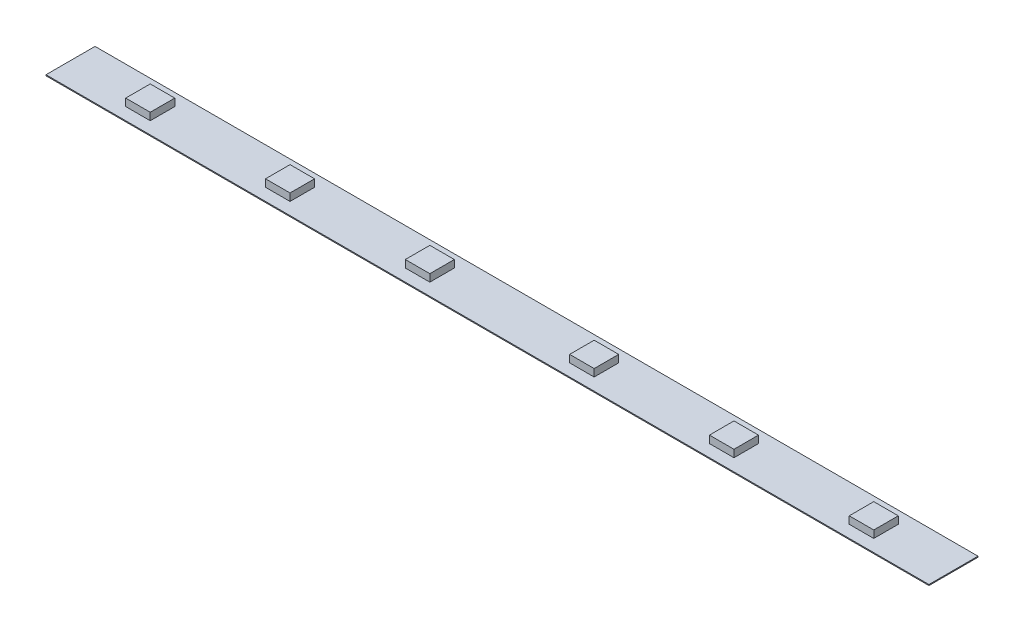
from build123d import *

# Parameters (mm, degrees)
ESQUISSE1_W        = 180
ESQUISSE1_H        = 10
BOSS_EXTRU_1_DEPTH = 0.2
ESQUISSE3_W        = 5
ESQUISSE3_H        = 5
BOSS_EXTRU_2_DEPTH = 1.5


with BuildPart() as part:
    # Esquisse1 → Boss.-Extru.1 (new body)
    with BuildSketch(Plane(origin=(0, 0, 0), x_dir=(1, 0, 0), z_dir=(0, 1, 0))):
        Rectangle(ESQUISSE1_W, ESQUISSE1_H)
    extrude(amount=BOSS_EXTRU_1_DEPTH)

    # Esquisse3 → Boss.-Extru.2 (add)
    with BuildSketch(Plane(origin=(0, 0.2, 0), x_dir=(1, 0, 0), z_dir=(0, 1, 0))):
        with Locations((45.25, 0)):
            Rectangle(ESQUISSE3_W, ESQUISSE3_H)
        with Locations((16.75, 0)):
            Rectangle(ESQUISSE3_W, ESQUISSE3_H)
        with Locations((73.75, 0)):
            Rectangle(ESQUISSE3_W, ESQUISSE3_H)
        with Locations((-73.75, 0)):
            Rectangle(ESQUISSE3_W, ESQUISSE3_H)
        with Locations((-45.25, 0)):
            Rectangle(ESQUISSE3_W, ESQUISSE3_H)
        with Locations((-16.75, 0)):
            Rectangle(ESQUISSE3_W, ESQUISSE3_H)
    extrude(amount=BOSS_EXTRU_2_DEPTH)


solid = part.part
